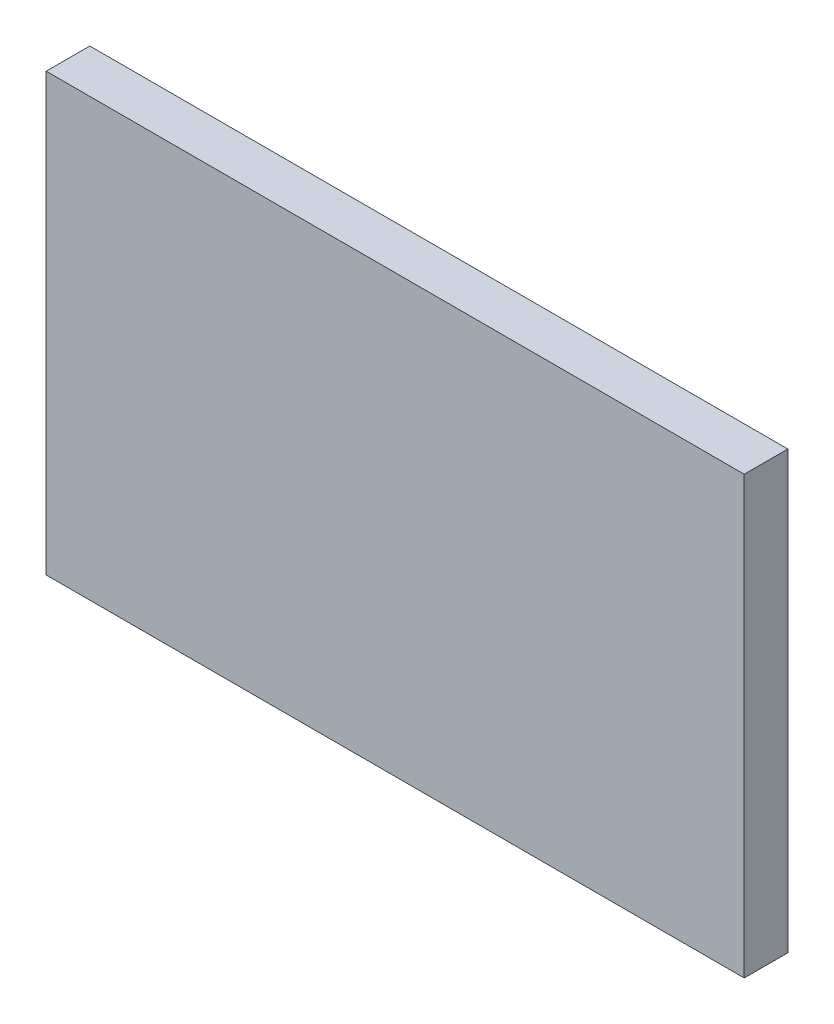
from build123d import *

# Parameters (mm, degrees)
SKETCH1_W           = 80
SKETCH1_H           = 50
BOSS_EXTRUDE1_DEPTH = 5


with BuildPart() as part:
    # Sketch1 → Boss-Extrude1 (new body)
    with BuildSketch(Plane.XY):
        Rectangle(SKETCH1_W, SKETCH1_H)
    extrude(amount=BOSS_EXTRUDE1_DEPTH)


solid = part.part
